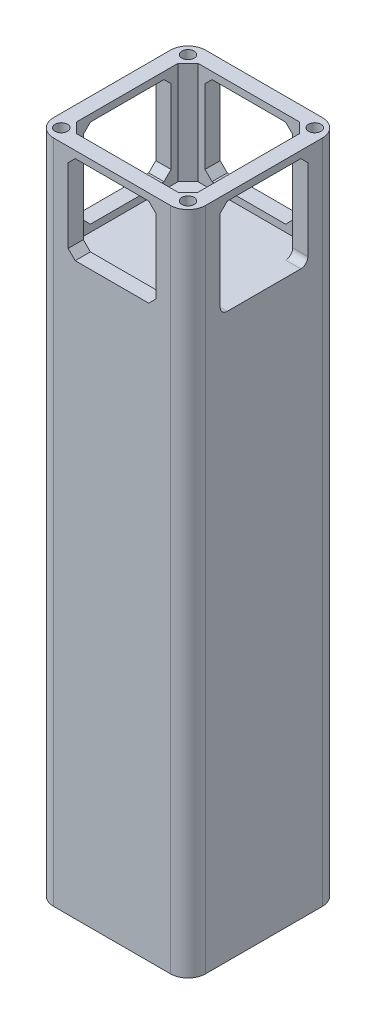
from build123d import *

# Parameters (mm, degrees)
BOSS_EXTRUDE1_DEPTH = 202.184
SKETCH2_R           = 2.1971
CUT_EXTRUDE1_DEPTH  = 6.7564
BOSS_EXTRUDE2_DEPTH = 36.83
CUT_EXTRUDE3_DEPTH  = 5.461
CIRPATTERN1_COUNT   = 4
SKETCH5_W           = 31.496
SKETCH5_H           = 5.08
CUT_EXTRUDE4_DEPTH  = 5.461
FILLET1_R           = 2.54
SKETCH6_R           = 2.2225
CUT_EXTRUDE5_DEPTH  = 3.81


with BuildPart() as part:
    # Sketch1 → Boss-Extrude1 (new body)
    with BuildSketch(Plane(origin=(0, 0, 0), x_dir=(1, 0, 0), z_dir=(0, 1, 0))):
        with BuildLine():
            Line((-20.955, -27.305), (20.955, -27.305))
            ThreePointArc((20.955, -27.305), (25.445128061, -25.445128061), (27.305, -20.955))
            Line((27.305, -20.955), (27.305, 20.955))
            ThreePointArc((27.305, 20.955), (25.445128061, 25.445128061), (20.955, 27.305))
            Line((20.955, 27.305), (-20.955, 27.305))
            ThreePointArc((-20.955, 27.305), (-25.445128061, 25.445128061), (-27.305, 20.955))
            Line((-27.305, 20.955), (-27.305, -20.955))
            ThreePointArc((-27.305, -20.955), (-25.445128061, -25.445128061), (-20.955, -27.305))
        make_face()
    extrude(amount=BOSS_EXTRUDE1_DEPTH)

    # Sketch2 → Cut-Extrude1 (cut)
    with BuildSketch(Plane.XZ):
        with Locations(Location((-17.78, 17.78, 0), (0, 0, 270))):
            Circle(SKETCH2_R)
        with Locations(Location((17.78, 17.78, 0), (0, 0, 90))):
            Circle(SKETCH2_R)
        with Locations(Location((17.78, -17.78, 0), (0, 0, 270))):
            Circle(SKETCH2_R)
        with Locations(Location((-17.78, -17.78, 0), (0, 0, 90))):
            Circle(SKETCH2_R)
    extrude(amount=-CUT_EXTRUDE1_DEPTH, mode=Mode.SUBTRACT)

    # Sketch3 → Boss-Extrude2 (add)
    with BuildSketch(Plane(origin=(0, 202.184, 0), x_dir=(1, 0, 0), z_dir=(0, 1, 0))):
        with BuildLine():
            Line((-27.305, 20.955), (-27.305, -20.955))
            ThreePointArc((-27.305, -20.955), (-25.445128061, -25.445128061), (-20.955, -27.305))
            Line((-20.955, -27.305), (20.955, -27.305))
            ThreePointArc((20.955, -27.305), (25.445128061, -25.445128061), (27.305, -20.955))
            Line((27.305, -20.955), (27.305, 20.955))
            ThreePointArc((27.305, 20.955), (25.445128061, 25.445128061), (20.955, 27.305))
            Line((20.955, 27.305), (-20.955, 27.305))
            ThreePointArc((-20.955, 27.305), (-25.445128061, 25.445128061), (-27.305, 20.955))
        make_face()
        Polygon((21.844, -18.288), (18.288, -21.844), (-18.288, -21.844), (-21.844, -18.288), (-21.844, 18.288), (-18.288, 21.844), (18.288, 21.844), (21.844, 18.288), align=None, mode=Mode.SUBTRACT)
    extrude(amount=BOSS_EXTRUDE2_DEPTH)

    # Sketch4 → Cut-Extrude3 (cut)
    with BuildSketch(Plane.ZY.offset(-21.844)):
        Polygon((-13.208, 236.474), (13.208, 236.474), (15.748, 233.934), (15.748, 207.264), (13.208, 204.724), (-13.208, 204.724), (-15.748, 207.264), (-15.748, 233.934), align=None)
    cut_extrude3 = extrude(amount=-CUT_EXTRUDE3_DEPTH, mode=Mode.SUBTRACT)

    # CirPattern1: Cut-Extrude3 ×4 about axis
    cirpattern1_axis = Axis((0, 0, 0), (0, 1, 0))
    for i in range(1, CIRPATTERN1_COUNT):
        add(cut_extrude3.rotate(cirpattern1_axis, i * 360 / CIRPATTERN1_COUNT), mode=Mode.SUBTRACT)

    # Sketch5 → Cut-Extrude4 (cut)
    with BuildSketch(Plane.ZY.offset(-21.844)):
        with Locations((0, 204.724)):
            Rectangle(SKETCH5_W, SKETCH5_H)
    extrude(amount=-CUT_EXTRUDE4_DEPTH, mode=Mode.SUBTRACT)

    # Fillet1
    fillet1_edges = [part.edges().sort_by_distance(p)[0] for p in [
        (24.5745, 202.184, 15.748),
        (24.5745, 202.184, -15.748),
    ]]
    fillet(fillet1_edges, radius=FILLET1_R)

    # Sketch6 → Cut-Extrude5 (cut)
    with BuildSketch(Plane(origin=(0, 239.014, 0), x_dir=(1, 0, 0), z_dir=(0, 1, 0))):
        with Locations(Location((22.75556403, -22.75556403, 0), (0, 0, 270))):
            Circle(SKETCH6_R)
        with Locations(Location((-22.75556403, -22.75556403, 0), (0, 0, 270))):
            Circle(SKETCH6_R)
        with Locations(Location((-22.75556403, 22.75556403, 0), (0, 0, 270))):
            Circle(SKETCH6_R)
        with Locations(Location((22.75556403, 22.75556403, 0), (0, 0, 270))):
            Circle(SKETCH6_R)
    extrude(amount=-CUT_EXTRUDE5_DEPTH, mode=Mode.SUBTRACT)


solid = part.part
